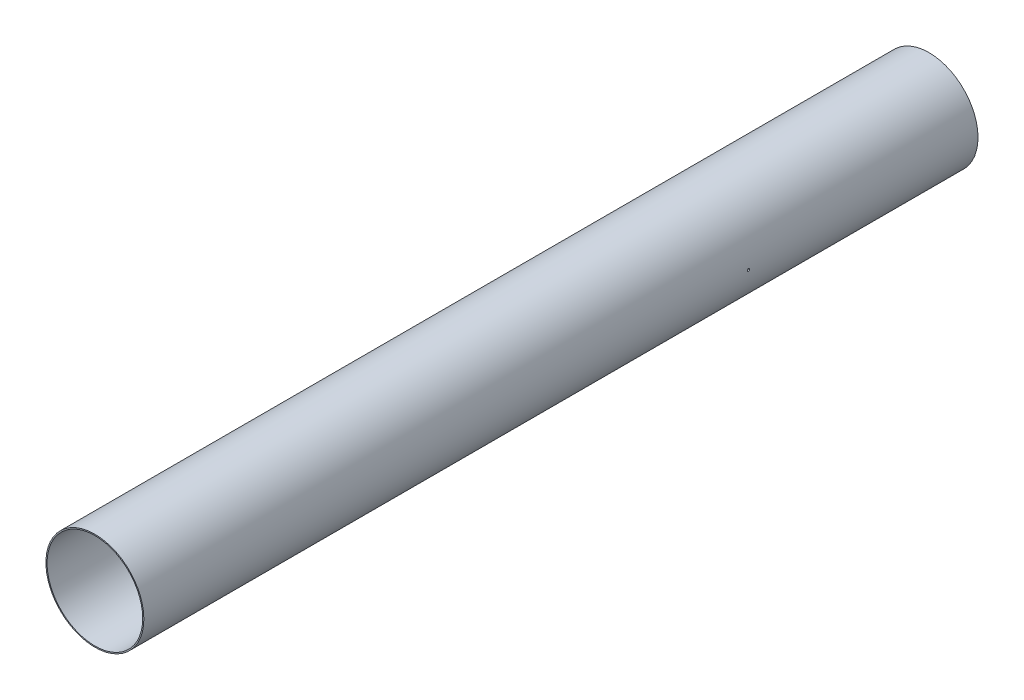
from build123d import *

# Parameters (mm, degrees)
SKETCH1_R           = 64
SKETCH1_R_2         = 62.5
BOSS_EXTRUDE1_DEPTH = 545
SKETCH2_R           = 1.5
CUT_EXTRUDE1_DEPTH  = 553.464478496


with BuildPart() as part:
    # Sketch1 → Boss-Extrude1 (new, symmetric)
    with BuildSketch(Plane.XY):
        Circle(SKETCH1_R)
        Circle(SKETCH1_R_2, mode=Mode.SUBTRACT)
    extrude(amount=BOSS_EXTRUDE1_DEPTH, both=True)

    # Sketch2 → Cut-Extrude1 (cut, through all)
    with BuildSketch(Plane(origin=(0, 0, 0), x_dir=(0, 0, -1), z_dir=(1, 0, 0))):
        with Locations(Location((245, 0, 0), (0, 0, 180))):
            Circle(SKETCH2_R)
    extrude(amount=CUT_EXTRUDE1_DEPTH, mode=Mode.SUBTRACT)


solid = part.part
